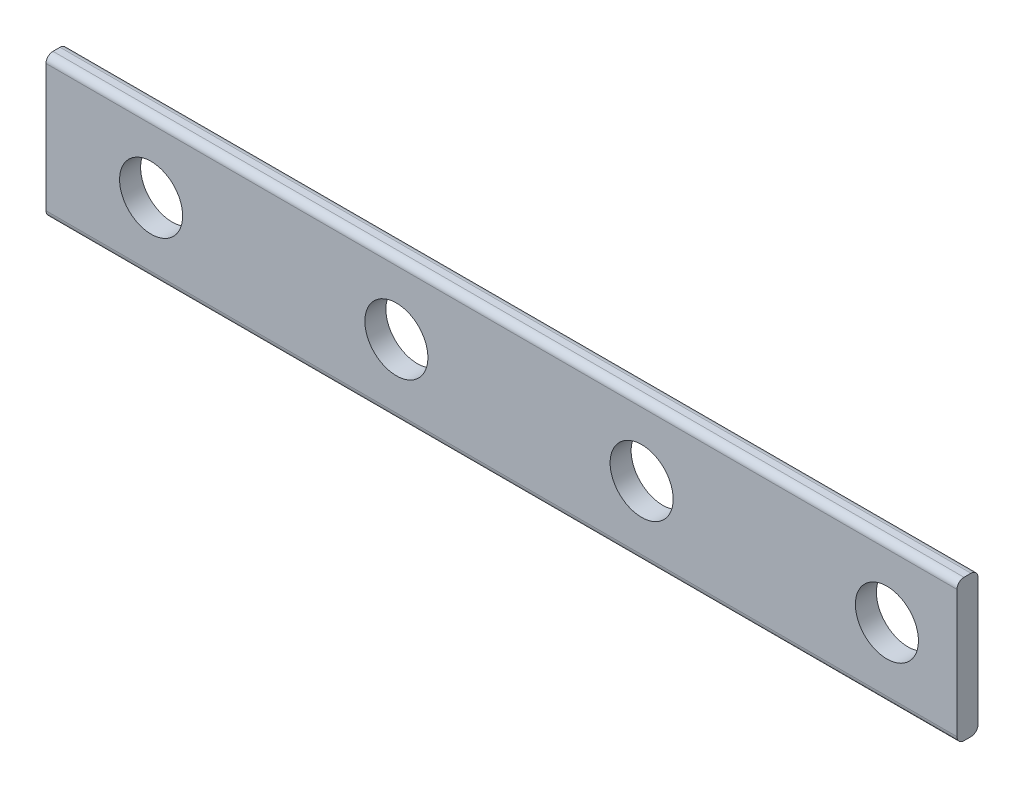
from build123d import *

# Parameters (mm, degrees)
SKETCH1_W           = 130
SKETCH1_H           = 20.2
SKETCH1_R           = 4.5
BOSS_EXTRUDE1_DEPTH = 3
FILLET1_R           = 1


with BuildPart() as part:
    # Sketch1 → Boss-Extrude1 (new body)
    with BuildSketch(Plane.XY):
        Rectangle(SKETCH1_W, SKETCH1_H)
        with Locations((-50, 0)):
            Circle(SKETCH1_R, mode=Mode.SUBTRACT)
        with Locations((-15, 0)):
            Circle(SKETCH1_R, mode=Mode.SUBTRACT)
        with Locations((20, 0)):
            Circle(SKETCH1_R, mode=Mode.SUBTRACT)
        with Locations((55, 0)):
            Circle(SKETCH1_R, mode=Mode.SUBTRACT)
    extrude(amount=BOSS_EXTRUDE1_DEPTH)

    # Fillet1
    fillet1_edges = [part.edges().sort_by_distance(p)[0] for p in [
        (0, -10.1, 3),
        (0, -10.1, 0),
        (0, 10.1, 0),
        (0, 10.1, 3),
    ]]
    fillet(fillet1_edges, radius=FILLET1_R)


solid = part.part
